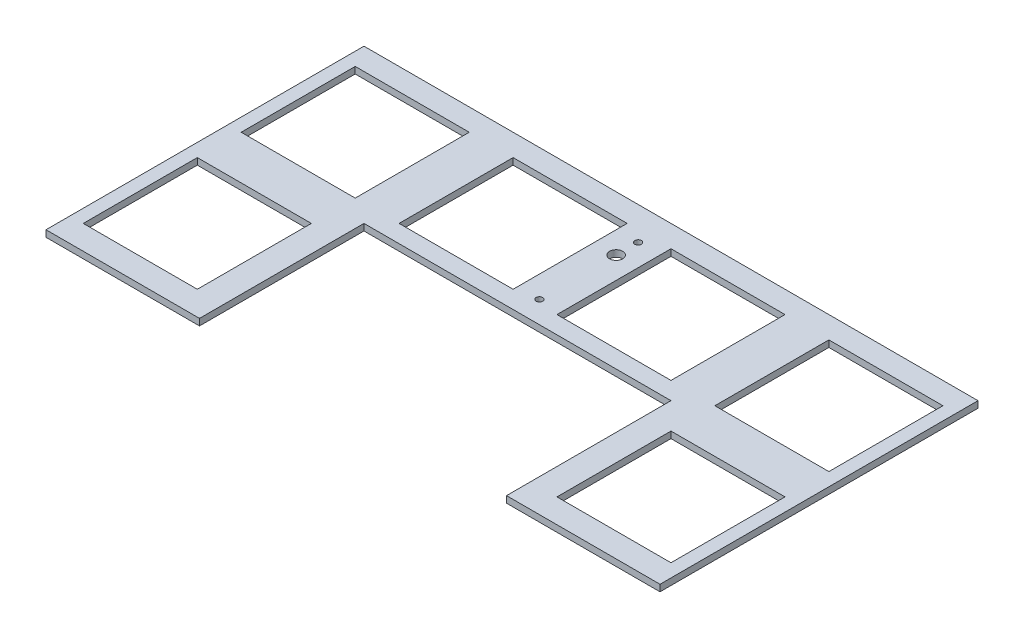
from build123d import *

# Parameters (mm, degrees)
SKETCH_1_R      = 1.5
SKETCH_1_R_2    = 3
SKETCH_1_W      = 52
SKETCH_1_H      = 52
EXTRUDE_1_DEPTH = 3


with BuildPart() as part:
    # 草图1 → 凸台-拉伸1 (new body)
    with BuildSketch(Plane(origin=(0, 0, 0), x_dir=(1, 0, 0), z_dir=(0, 1, 0))):
        Polygon((-140, -50), (-70, -50), (-70, 25), (70, 25), (70, -50), (140, -50), (140, 95), (-140, 95), align=None)
        with Locations(Location((0, 80, 0), (0, 0, 270))):
            Circle(SKETCH_1_R, mode=Mode.SUBTRACT)
        with Locations(Location((0, 35, 0), (0, 0, 270))):
            Circle(SKETCH_1_R, mode=Mode.SUBTRACT)
        with Locations(Location((0, 70, 0), (0, 0, 270))):
            Circle(SKETCH_1_R_2, mode=Mode.SUBTRACT)
        with Locations((36, 59)):
            Rectangle(SKETCH_1_W, SKETCH_1_H, mode=Mode.SUBTRACT)
        with Locations((-36, 59)):
            Rectangle(SKETCH_1_W, SKETCH_1_H, mode=Mode.SUBTRACT)
        with Locations((-108, 59)):
            Rectangle(SKETCH_1_W, SKETCH_1_H, mode=Mode.SUBTRACT)
        with Locations((108, 59)):
            Rectangle(SKETCH_1_W, SKETCH_1_H, mode=Mode.SUBTRACT)
        with Locations((-108, -13)):
            Rectangle(SKETCH_1_W, SKETCH_1_H, mode=Mode.SUBTRACT)
        with Locations((108, -13)):
            Rectangle(SKETCH_1_W, SKETCH_1_H, mode=Mode.SUBTRACT)
    extrude(amount=EXTRUDE_1_DEPTH)


solid = part.part
